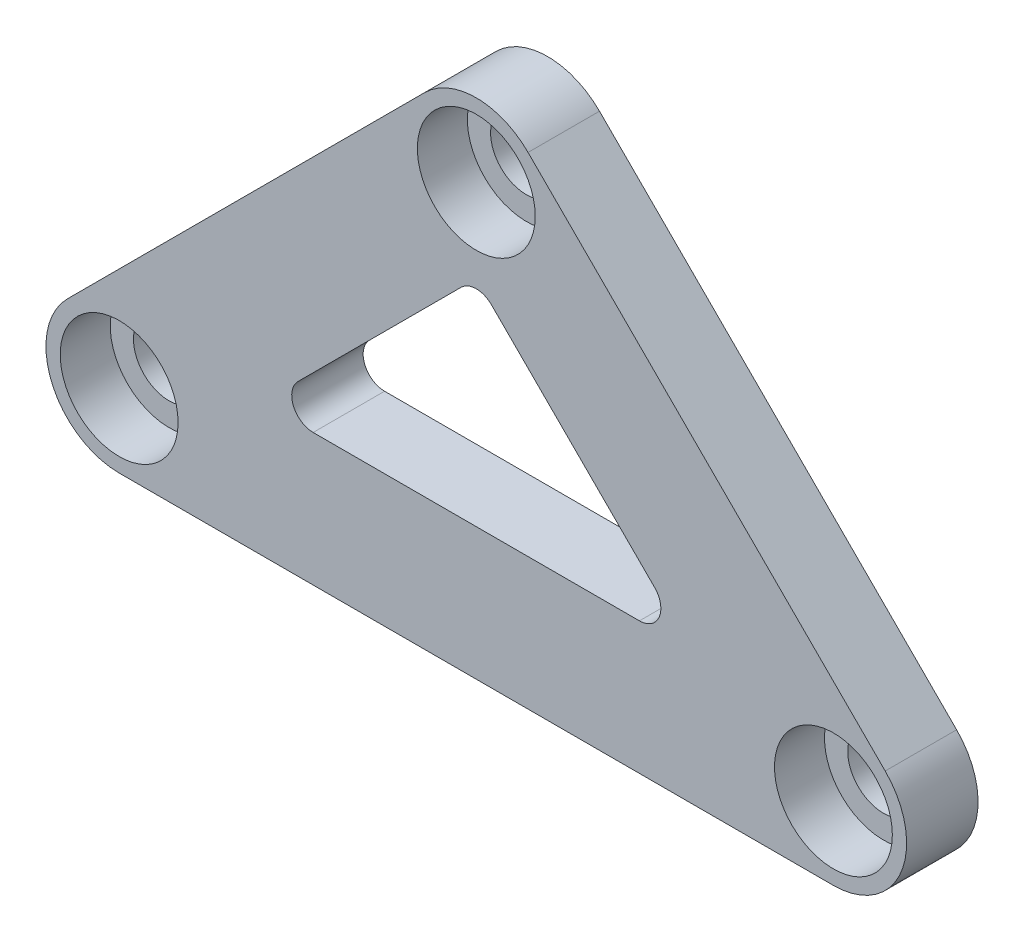
from build123d import *

# Parameters (mm, degrees)
BOSS_EXTRUDE1_DEPTH = 10
SKETCH2_R           = 8.25
CUT_EXTRUDE1_DEPTH  = 7
CUT_EXTRUDE2_DEPTH  = 16
FILLET2_R           = 3
SKETCH5_R           = 5
CUT_EXTRUDE3_DEPTH  = 16


with BuildPart() as part:
    # Sketch1 → Boss-Extrude1 (new body)
    with BuildSketch(Plane.XY):
        with BuildLine():
            Line((0, 10.25), (100, 10.25))
            ThreePointArc((100, 10.25), (110.25, 0), (100, -10.25))
            Line((100, -10.25), (0, -10.25))
            ThreePointArc((0, -10.25), (-10.25, 0), (0, 10.25))
        make_face()
        with BuildLine():
            Line((92.752155493, -7.247844507), (42.752155493, 42.752155493))
            ThreePointArc((42.752155493, 42.752155493), (42.752155493, 57.247844507), (57.247844507, 57.247844507))
            Line((57.247844507, 57.247844507), (107.247844507, 7.247844507))
            ThreePointArc((107.247844507, 7.247844507), (107.247844507, -7.247844507), (92.752155493, -7.247844507))
        make_face()
        with BuildLine():
            Line((57.247844507, 42.752155493), (7.247844507, -7.247844507))
            ThreePointArc((7.247844507, -7.247844507), (-7.247844507, -7.247844507), (-7.247844507, 7.247844507))
            Line((-7.247844507, 7.247844507), (42.752155493, 57.247844507))
            ThreePointArc((42.752155493, 57.247844507), (57.247844507, 57.247844507), (57.247844507, 42.752155493))
        make_face()
    extrude(amount=BOSS_EXTRUDE1_DEPTH)

    # Sketch2 → Cut-Extrude1 (cut)
    with BuildSketch(Plane.XY.offset(10)):
        with Locations((50, 50)):
            Circle(SKETCH2_R)
        with Locations((100, 0)):
            Circle(SKETCH2_R)
        Circle(SKETCH2_R)
    extrude(amount=-CUT_EXTRUDE1_DEPTH, mode=Mode.SUBTRACT)

    # Sketch4 → Cut-Extrude2 (cut)
    with BuildSketch(Plane.XY.offset(10)):
        Polygon((19.91726189, 8.25), (80.08273811, 8.25), (50, 38.33273811), align=None)
    extrude(amount=-CUT_EXTRUDE2_DEPTH, mode=Mode.SUBTRACT)

    # Fillet2
    fillet2_edges = [part.edges().sort_by_distance(p)[0] for p in [
        (19.91726189, 8.25, 5),
        (50, 38.33273811, 5),
        (80.08273811, 8.25, 5),
    ]]
    fillet(fillet2_edges, radius=FILLET2_R)

    # Sketch5 → Cut-Extrude3 (cut)
    with BuildSketch(Plane.XY.offset(10)):
        Circle(SKETCH5_R)
        with Locations((50, 50)):
            Circle(SKETCH5_R)
        with Locations((100, 0)):
            Circle(SKETCH5_R)
    extrude(amount=-CUT_EXTRUDE3_DEPTH, mode=Mode.SUBTRACT)


solid = part.part
